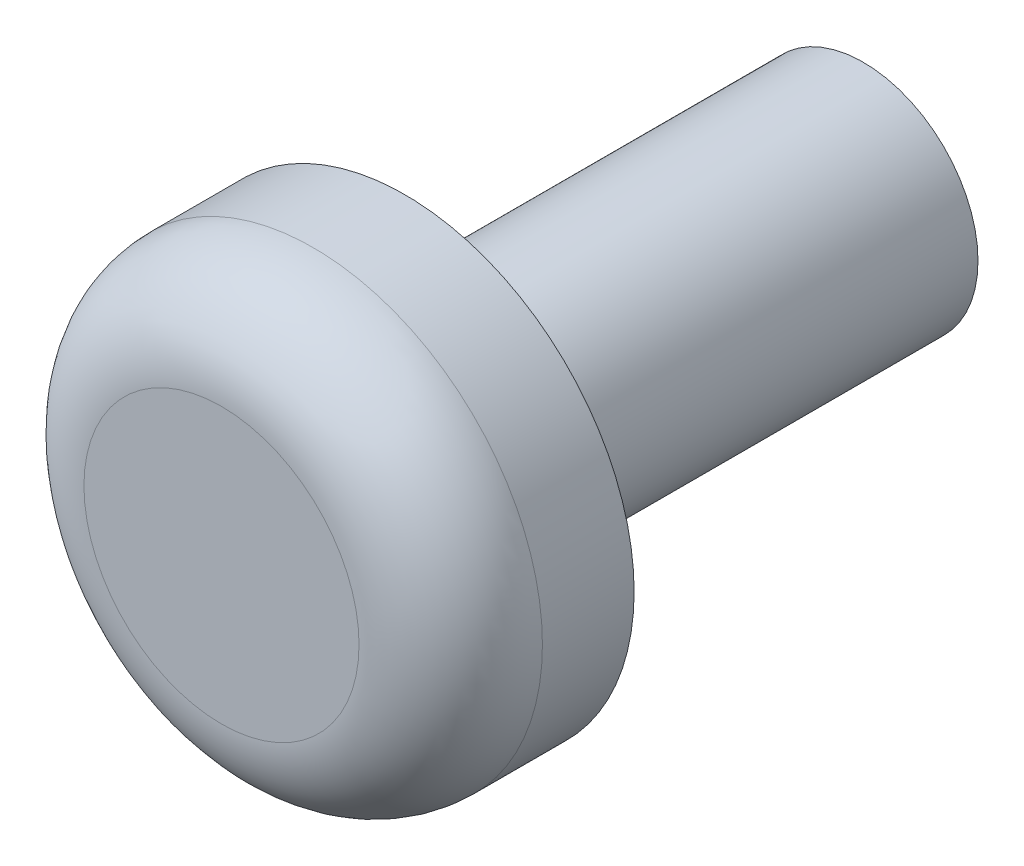
from build123d import *

# Parameters (mm, degrees)
SKETCH1_R           = 1.25
BOSS_EXTRUDE1_DEPTH = 5
SKETCH2_R           = 2.5
BOSS_EXTRUDE2_DEPTH = 2
FILLET1_R           = 1


with BuildPart() as part:
    # Sketch1 → Boss-Extrude1 (new body)
    with BuildSketch(Plane.XY):
        Circle(SKETCH1_R)
    extrude(amount=BOSS_EXTRUDE1_DEPTH)

    # Sketch2 → Boss-Extrude2 (add)
    with BuildSketch(Plane.XY.offset(5)):
        Circle(SKETCH2_R)
    extrude(amount=BOSS_EXTRUDE2_DEPTH)

    # Fillet1
    fillet1_edges = [part.edges().sort_by_distance(p)[0] for p in [
        (-2.5, 0, 7),
    ]]
    fillet(fillet1_edges, radius=FILLET1_R)


solid = part.part
